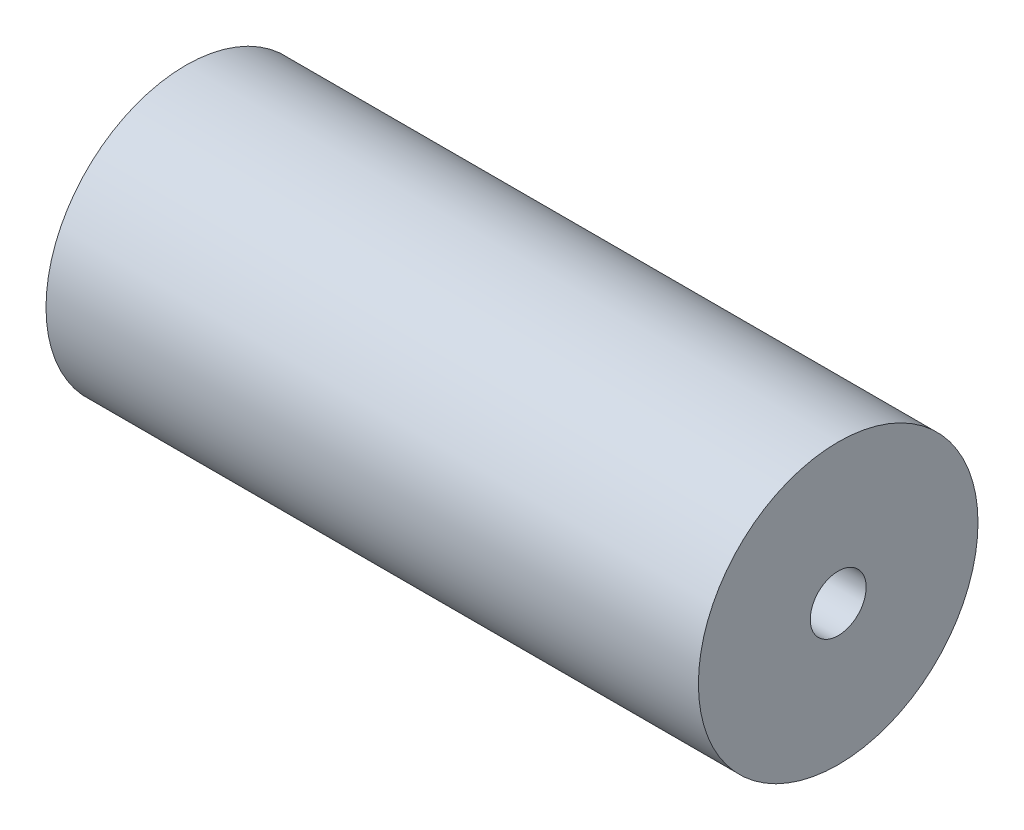
from build123d import *

# Parameters (mm, degrees)
SKETCH1_W = 44.45
SKETCH1_H = 7.62


with BuildPart() as part:
    # Sketch1 → Revolve1 (revolve)
    with BuildSketch(Plane.XY, mode=Mode.PRIVATE) as revolve1_sk:
        with Locations((0, 5.715)):
            Rectangle(SKETCH1_W, SKETCH1_H)
    revolve(revolve1_sk.sketch.rotate(Axis((-22.225, 0, 0), (1, 0, 0)), 180), axis=Axis((-22.225, 0, 0), (1, 0, 0)))


solid = part.part
